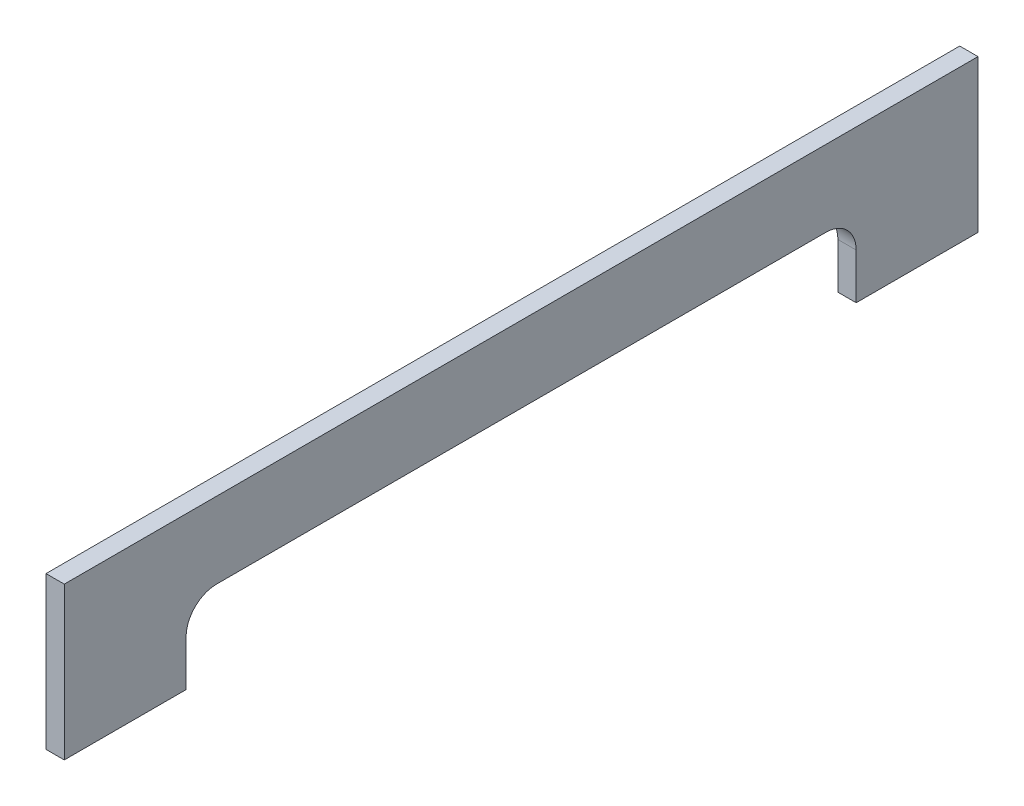
from build123d import *

# Parameters (mm, degrees)
SKETCH1_W           = 300
SKETCH1_H           = 50
BOSS_EXTRUDE1_DEPTH = 6
SKETCH2_W           = 220
SKETCH2_H           = 25
CUT_EXTRUDE1_DEPTH  = 10
FILLET1_R           = 10


with BuildPart() as part:
    # Sketch1 → Boss-Extrude1 (new body)
    with BuildSketch(Plane(origin=(0, 0, 0), x_dir=(0, 0, -1), z_dir=(1, 0, 0))):
        Rectangle(SKETCH1_W, SKETCH1_H)
    extrude(amount=BOSS_EXTRUDE1_DEPTH)

    # Sketch2 → Cut-Extrude1 (cut)
    with BuildSketch(Plane(origin=(6, 0, 0), x_dir=(0, 0, -1), z_dir=(1, 0, 0))):
        with Locations((0, -12.5)):
            Rectangle(SKETCH2_W, SKETCH2_H)
    extrude(amount=-CUT_EXTRUDE1_DEPTH, mode=Mode.SUBTRACT)

    # Fillet1
    fillet1_edges = [part.edges().sort_by_distance(p)[0] for p in [
        (3, 0, 110),
        (3, 0, -110),
    ]]
    fillet(fillet1_edges, radius=FILLET1_R)


solid = part.part
